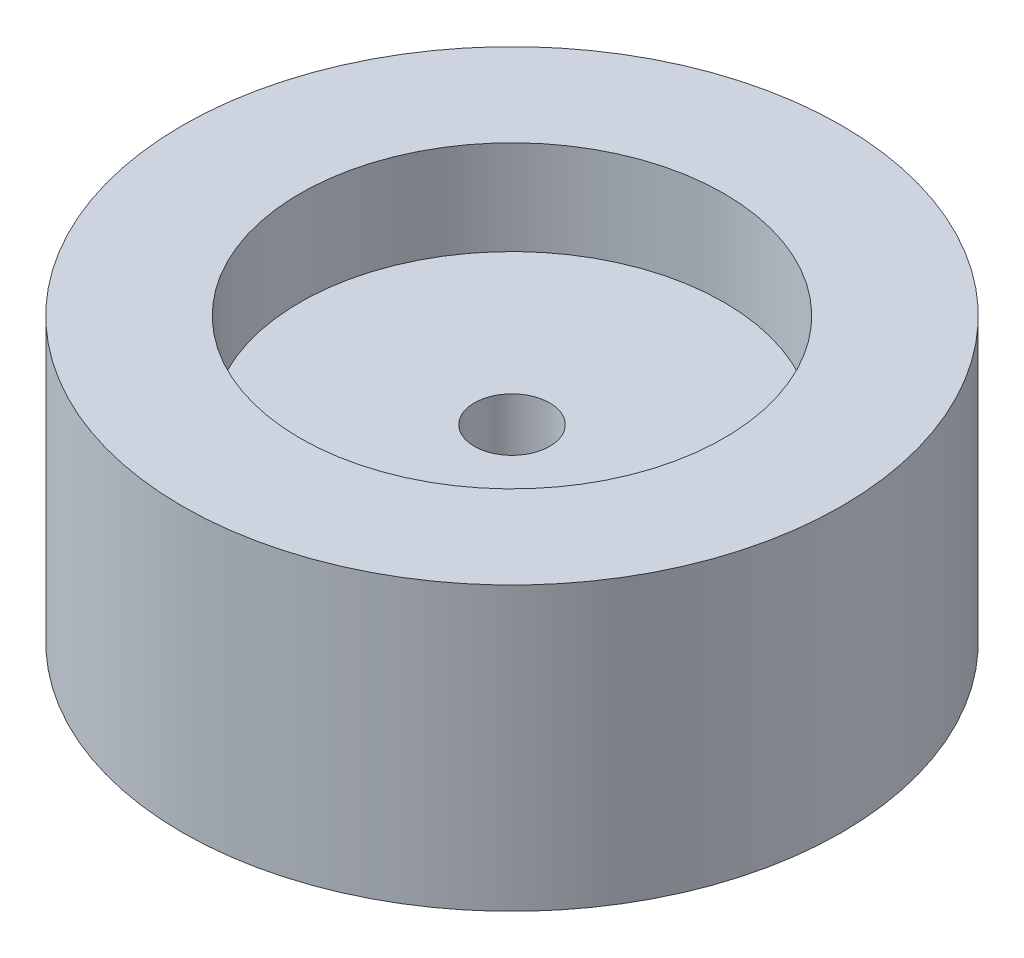
from build123d import *

# Parameters (mm, degrees)
SKETCH1_R           = 35
BOSS_EXTRUDE1_DEPTH = 30
SKETCH2_R           = 22.5
CUT_EXTRUDE1_DEPTH  = 10
CUT_EXTRUDE2_START  = -10
SKETCH3_R           = 22.5
CUT_EXTRUDE2_DEPTH  = 10
SKETCH4_R           = 4
CUT_EXTRUDE3_DEPTH  = 10


with BuildPart() as part:
    # Sketch1 → Boss-Extrude1 (new body)
    with BuildSketch(Plane(origin=(0, 0, 0), x_dir=(1, 0, 0), z_dir=(0, 1, 0))):
        with Locations(Location((0, 0, 0), (0, 0, 270))):
            Circle(SKETCH1_R)
    extrude(amount=BOSS_EXTRUDE1_DEPTH)

    # Sketch2 → Cut-Extrude1 (cut)
    with BuildSketch(Plane(origin=(0, 30, 0), x_dir=(1, 0, 0), z_dir=(0, 1, 0))):
        with Locations(Location((0, 0, 0), (0, 0, 270))):
            Circle(SKETCH2_R)
    extrude(amount=-CUT_EXTRUDE1_DEPTH, mode=Mode.SUBTRACT)

    # Sketch3 → Cut-Extrude2 (cut)
    with BuildSketch(Plane.XZ.offset(CUT_EXTRUDE2_START)):
        with Locations(Location((0, 0, 0), (0, 0, 90))):
            Circle(SKETCH3_R)
    extrude(amount=CUT_EXTRUDE2_DEPTH, mode=Mode.SUBTRACT)

    # Sketch4 → Cut-Extrude3 (cut)
    with BuildSketch(Plane.XZ.offset(-10)):
        with Locations(Location((0, 0, 0), (0, 0, 270))):
            Circle(SKETCH4_R)
    extrude(amount=-CUT_EXTRUDE3_DEPTH, mode=Mode.SUBTRACT)


solid = part.part
